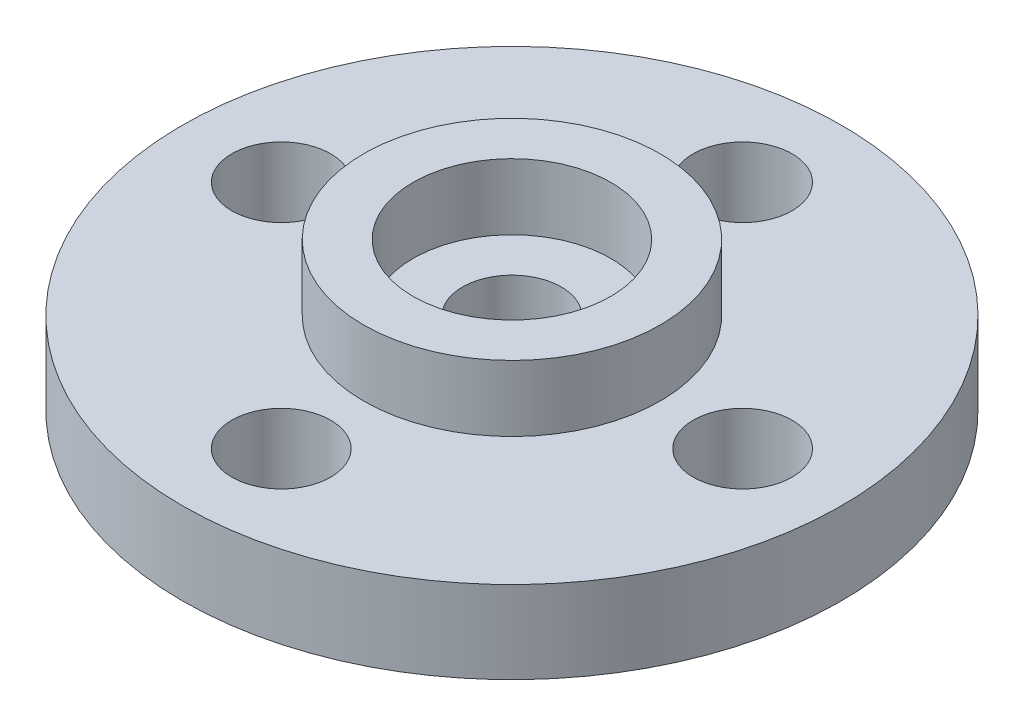
from build123d import *

# Parameters (mm, degrees)
SKETCH_1_R      = 10
SKETCH_1_R_2    = 1.5
EXTRUDE_1_DEPTH = 2.5
SKETCH_2_R      = 4.5
SKETCH_2_R_2    = 3
EXTRUDE_2_DEPTH = 2


with BuildPart() as part:
    # 草图1 → 凸台-拉伸1 (new body)
    with BuildSketch(Plane(origin=(0, 0, 0), x_dir=(1, 0, 0), z_dir=(0, 1, 0))):
        with Locations(Location((0, 0, 0), (0, 0, 270))):
            Circle(SKETCH_1_R)
        with Locations(Location((-7, 0, 0), (0, 0, 270))):
            Circle(SKETCH_1_R_2, mode=Mode.SUBTRACT)
        with Locations(Location((0, -7, 0), (0, 0, 270))):
            Circle(SKETCH_1_R_2, mode=Mode.SUBTRACT)
        with Locations(Location((7, 0, 0), (0, 0, 270))):
            Circle(SKETCH_1_R_2, mode=Mode.SUBTRACT)
        with Locations(Location((0, 7, 0), (0, 0, 270))):
            Circle(SKETCH_1_R_2, mode=Mode.SUBTRACT)
        with Locations(Location((0, 0, 0), (0, 0, 270))):
            Circle(SKETCH_1_R_2, mode=Mode.SUBTRACT)
    extrude(amount=EXTRUDE_1_DEPTH)

    # 草图2 → 凸台-拉伸2 (add)
    with BuildSketch(Plane(origin=(0, 2.5, 0), x_dir=(1, 0, 0), z_dir=(0, 1, 0))):
        with Locations(Location((0, 0, 0), (0, 0, 270))):
            Circle(SKETCH_2_R)
        with Locations(Location((0, 0, 0), (0, 0, 270))):
            Circle(SKETCH_2_R_2, mode=Mode.SUBTRACT)
    extrude(amount=EXTRUDE_2_DEPTH)


solid = part.part
